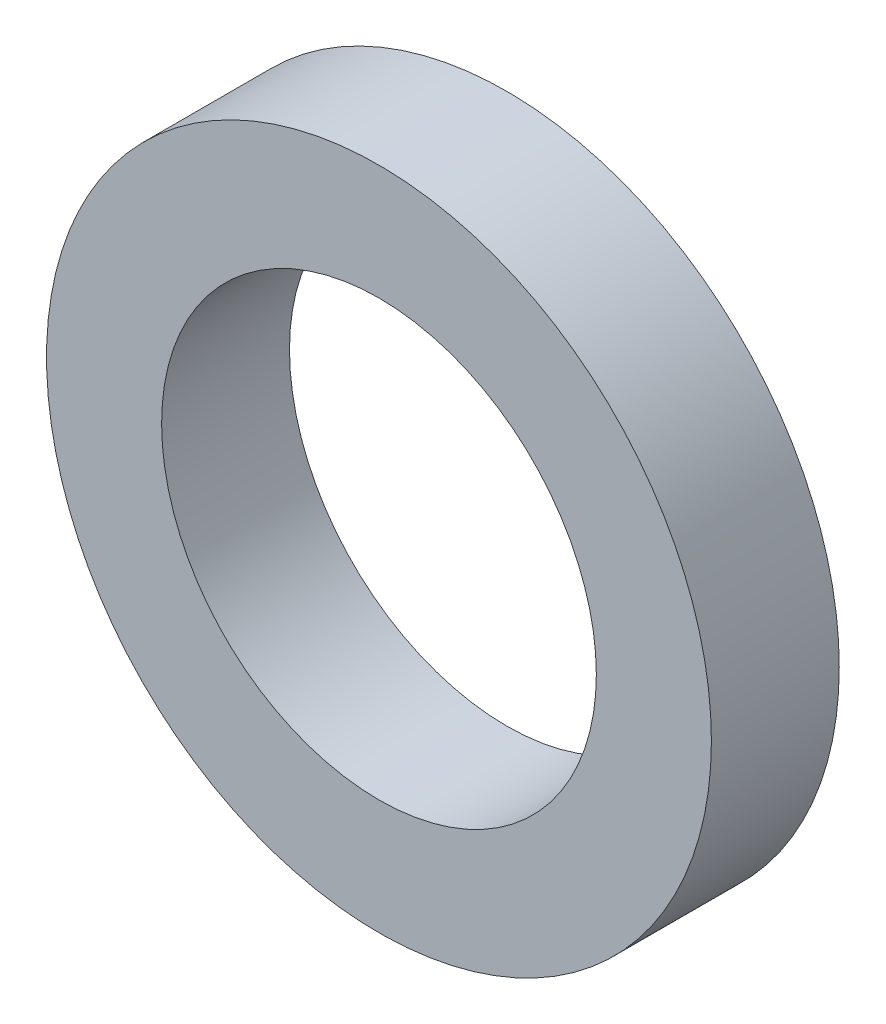
from build123d import *

# Parameters (mm, degrees)
BEARING6803_START = -20
SKETCH_1_R        = 13
SKETCH_1_R_2      = 8.5
BEARING6803_DEPTH = 5


with BuildPart() as part:
    # Эскиз1 → Bearing6803 (new body)
    with BuildSketch(Plane.XY.offset(BEARING6803_START)):
        Circle(SKETCH_1_R)
        Circle(SKETCH_1_R_2, mode=Mode.SUBTRACT)
    extrude(amount=BEARING6803_DEPTH)


solid = part.part
